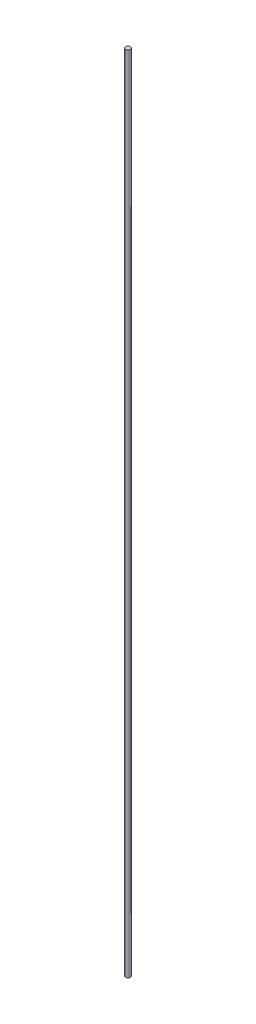
from build123d import *

# Parameters (mm, degrees)
SKETCH1_R           = 3
BOSS_EXTRUDE1_DEPTH = 1000
BOSS_EXTRUDE2_START = -6
SKETCH1_2_R         = 3
BOSS_EXTRUDE2_DEPTH = 6


with BuildPart() as part:
    # Sketch1 → Boss-Extrude1 (new body)
    with BuildSketch(Plane(origin=(0, 0, 0), x_dir=(1, 0, 0), z_dir=(0, 1, 0))):
        Circle(SKETCH1_R)
    extrude(amount=BOSS_EXTRUDE1_DEPTH)

    # Sketch1<2> → Boss-Extrude2 (add)
    with BuildSketch(Plane(origin=(0, 0, 0), x_dir=(1, 0, 0), z_dir=(0, 1, 0)).offset(BOSS_EXTRUDE2_START)):
        Circle(SKETCH1_2_R)
    extrude(amount=BOSS_EXTRUDE2_DEPTH)


solid = part.part
